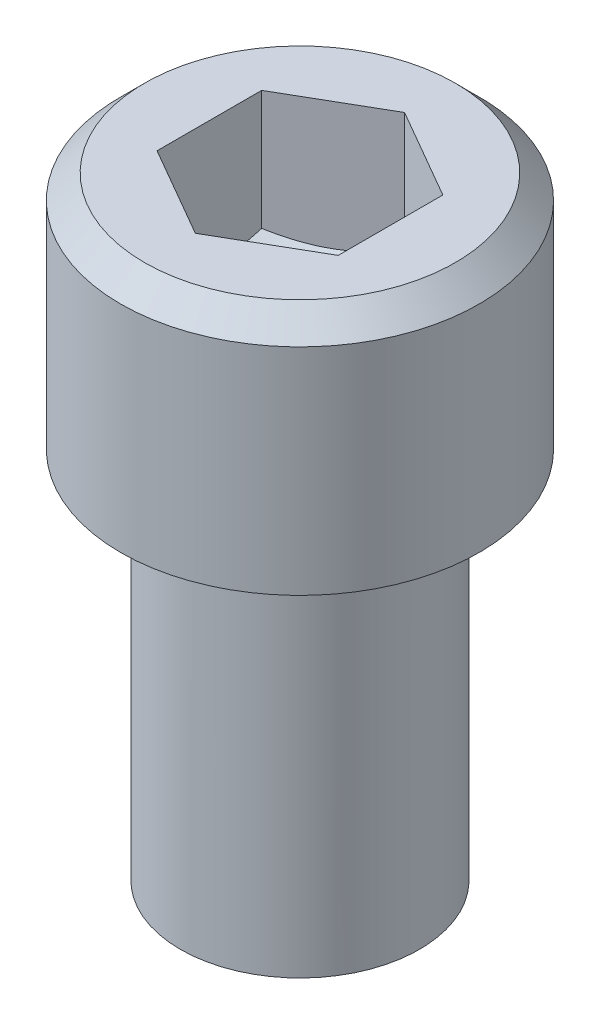
from build123d import *

# Parameters (mm, degrees)
CROQUIS4_R               = 12
SALIENTE_EXTRUIR3_DEPTH  = 16
CHAFL_N2_SIZE            = 1.6
CROQUIS6_13_R            = 8
SALIENTE_EXTRUIR15_DEPTH = 25


with BuildPart() as part:
    # Croquis4 → Saliente-Extruir3 (new body)
    with BuildSketch(Plane(origin=(0, 0, 0), x_dir=(1, 0, 0), z_dir=(0, 1, 0))):
        Circle(CROQUIS4_R)
        Polygon((0, 7), (-6.062177826, 3.5), (-6.062177826, -3.5), (0, -7), (6.062177826, -3.5), (6.062177826, 3.5), align=None, mode=Mode.SUBTRACT)
    extrude(amount=SALIENTE_EXTRUIR3_DEPTH)

    # Chaflán2
    chafl_n2_edges = [part.edges().sort_by_distance(p)[0] for p in [
        (-12, 16, 0),
    ]]
    chamfer(chafl_n2_edges, length=CHAFL_N2_SIZE)

    # Croquis5 → Revolución2 (revolve)
    with BuildSketch(Plane.XY):
        Polygon((0, 0), (0, 3.958548116), (7, 8), (12, 8), (12, 0), align=None)
    revolve(axis=Axis((0, 0, 0), (0, 1, 0)))

    # Croquis6<13> → Saliente-Extruir15 (add)
    with BuildSketch(Plane.XZ):
        Circle(CROQUIS6_13_R)
    extrude(amount=SALIENTE_EXTRUIR15_DEPTH)


solid = part.part
